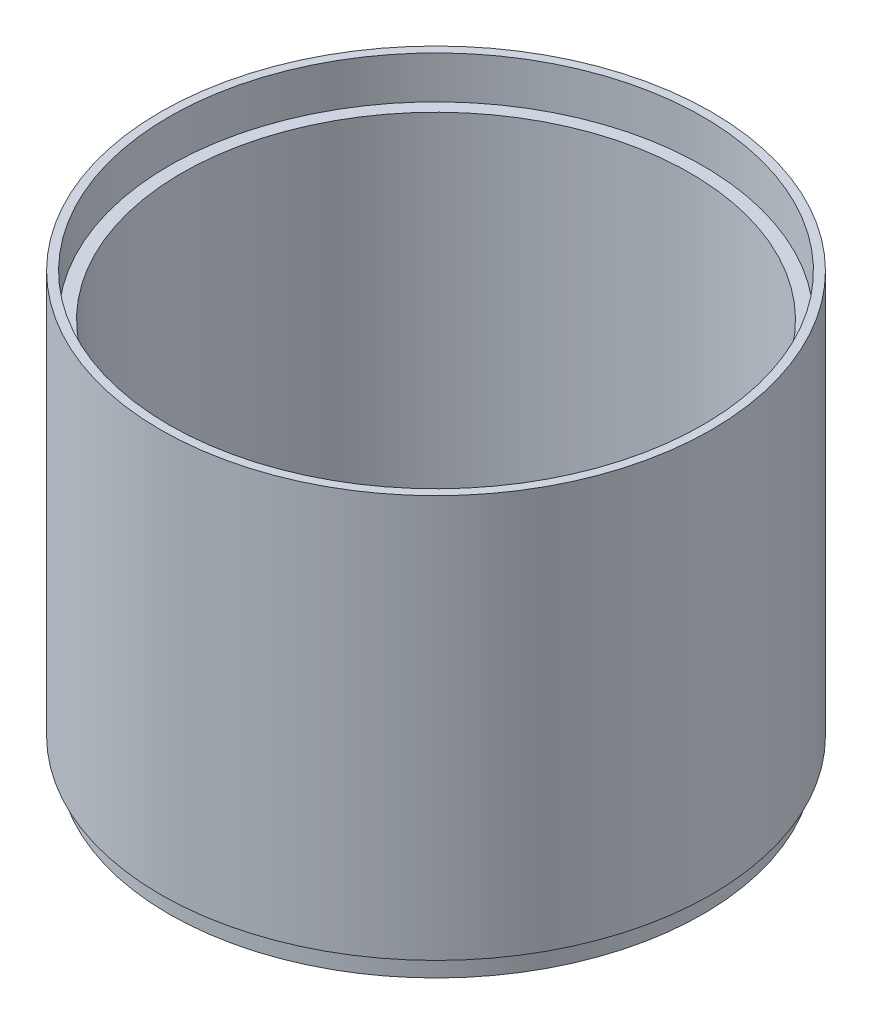
from build123d import *


with BuildPart() as part:
    # Szkic1 → Obrót1 (revolve)
    with BuildSketch(Plane.XY, mode=Mode.PRIVATE) as obr_t1_sk:
        Polygon((-63, 5), (-63, 0), (-60, 0), (-60, 90), (-63, 90), (-63, 100), (-65, 100), (-65, 28.561789866), (-65, 5), align=None)
    revolve(obr_t1_sk.sketch.rotate(Axis((0, 35.541039942, 0), (0, -1, 0)), 270), axis=Axis((0, 35.541039942, 0), (0, -1, 0)))


solid = part.part
